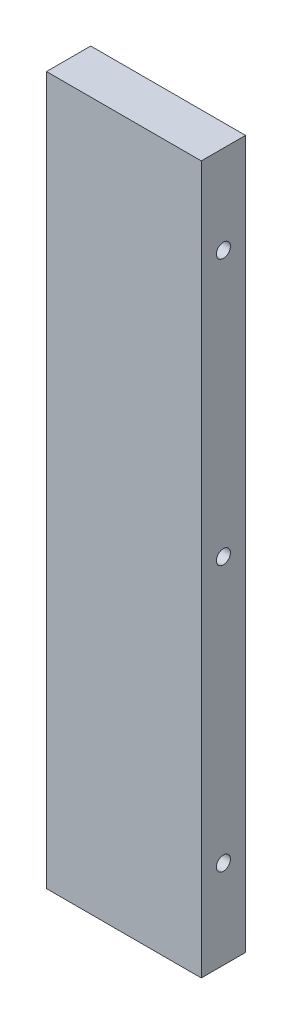
from build123d import *

# Parameters (mm, degrees)
SKETCH1_W              = 44.45
SKETCH1_H              = 203.2
BOSS_EXTRUDE1_DEPTH    = 12.7
F_10_32_TAPPED_HOLE1_D = 4.0386


with BuildPart() as part:
    # Sketch1 → Boss-Extrude1 (new body)
    with BuildSketch(Plane.XY):
        with Locations((-22.225, 23.319966314)):
            Rectangle(SKETCH1_W, SKETCH1_H)
    extrude(amount=BOSS_EXTRUDE1_DEPTH)

    # #10-32 Tapped Hole1 (through all)
    with Locations(Plane(origin=(0, 0, 0), x_dir=(0, 0, -1), z_dir=(1, 0, 0))):
        with Locations((-6.35, 99.519966314), (-6.35, 23.319966314), (-6.35, -52.880033686)):
            Hole(F_10_32_TAPPED_HOLE1_D / 2)


solid = part.part
